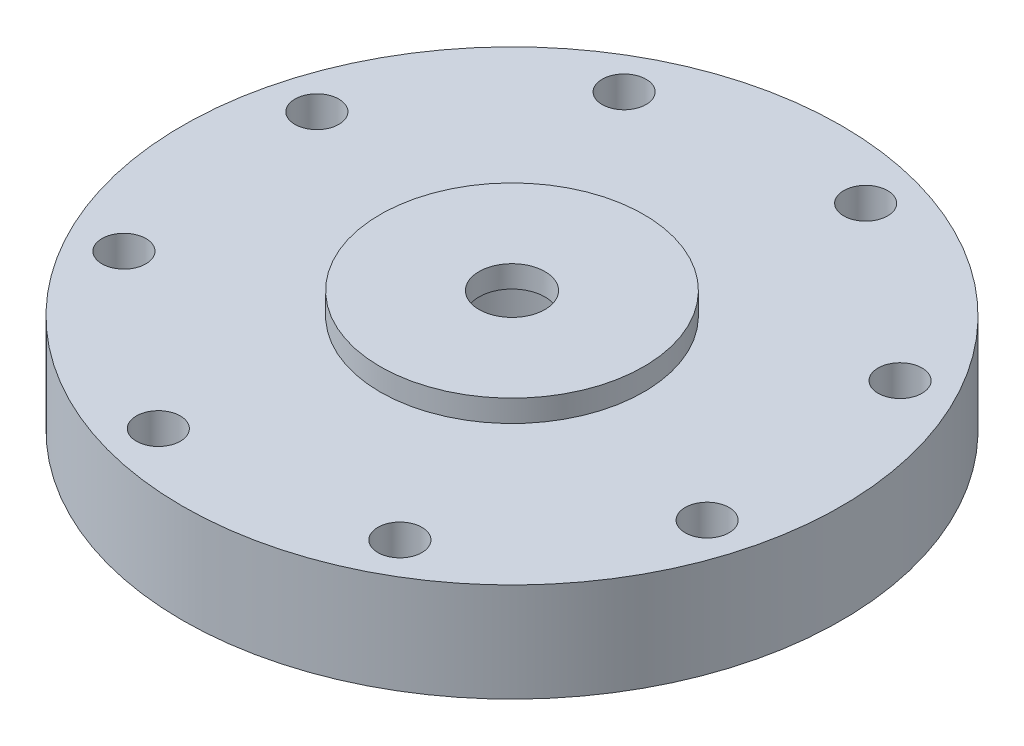
from build123d import *

# Parameters (mm, degrees)
SKETCH_1_R          = 15
EXTRUDE_1_DEPTH     = 2.25
SKETCH_2_R          = 6
EXTRUDE_2_DEPTH     = 1
SKETCH_3_R          = 1
CUT_EXTRUDE_1_DEPTH = 5
SKETCH_4_R          = 4
CUT_EXTRUDE_2_DEPTH = 4.5
SKETCH_5_R          = 1.5
CUT_EXTRUDE_3_DEPTH = 4.5


with BuildPart() as part:
    # ｽｹｯﾁ1 → ﾎﾞｽ - 押し出し1 (new, symmetric)
    with BuildSketch(Plane(origin=(0, 0, 0), x_dir=(1, 0, 0), z_dir=(0, 1, 0))):
        with Locations(Location((0, 0, 0), (0, 0, 270))):
            Circle(SKETCH_1_R)
    extrude(amount=EXTRUDE_1_DEPTH, both=True)

    # ｽｹｯﾁ2 → ﾎﾞｽ - 押し出し2 (add)
    with BuildSketch(Plane(origin=(0, 2.25, 0), x_dir=(1, 0, 0), z_dir=(0, 1, 0))):
        with Locations(Location((0, 0, 0), (0, 0, 270))):
            Circle(SKETCH_2_R)
    extrude(amount=EXTRUDE_2_DEPTH)

    # ｽｹｯﾁ3 → ｶｯﾄ - 押し出し1 (cut)
    with BuildSketch(Plane(origin=(0, 2.25, 0), x_dir=(1, 0, 0), z_dir=(0, 1, 0))):
        with Locations(Location((-11.382561056, -6.279912723, 0), (0, 0, 270))):
            Circle(SKETCH_3_R)
        with Locations(Location((-12.489254982, 3.608117238, 0), (0, 0, 270))):
            Circle(SKETCH_3_R)
        with Locations(Location((-6.279912723, 11.382561056, 0), (0, 0, 270))):
            Circle(SKETCH_3_R)
        with Locations(Location((3.608117238, 12.489254982, 0), (0, 0, 270))):
            Circle(SKETCH_3_R)
        with Locations(Location((11.382561056, 6.279912723, 0), (0, 0, 270))):
            Circle(SKETCH_3_R)
        with Locations(Location((12.489254982, -3.608117238, 0), (0, 0, 270))):
            Circle(SKETCH_3_R)
        with Locations(Location((6.279912723, -11.382561056, 0), (0, 0, 270))):
            Circle(SKETCH_3_R)
        with Locations(Location((-3.608117238, -12.489254982, 0), (0, 0, 270))):
            Circle(SKETCH_3_R)
    extrude(amount=-CUT_EXTRUDE_1_DEPTH, mode=Mode.SUBTRACT)

    # ｽｹｯﾁ4 → ｶｯﾄ - 押し出し2 (cut)
    with BuildSketch(Plane.XZ.offset(2.25)):
        with Locations(Location((0, 0, 0), (0, 0, 270))):
            Circle(SKETCH_4_R)
    extrude(amount=-CUT_EXTRUDE_2_DEPTH, mode=Mode.SUBTRACT)

    # ｽｹｯﾁ5 → ｶｯﾄ - 押し出し3 (cut)
    with BuildSketch(Plane(origin=(0, 3.25, 0), x_dir=(1, 0, 0), z_dir=(0, 1, 0))):
        with Locations(Location((0, 0, 0), (0, 0, 270))):
            Circle(SKETCH_5_R)
    extrude(amount=-CUT_EXTRUDE_3_DEPTH, mode=Mode.SUBTRACT)


solid = part.part
